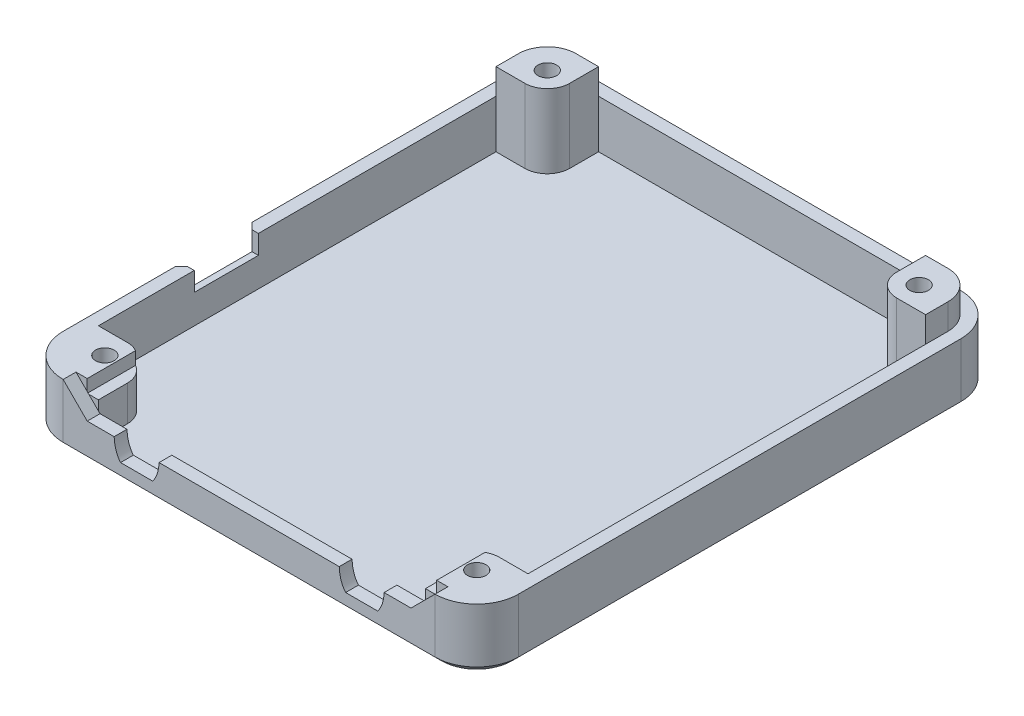
from build123d import *

# Parameters (mm, degrees)
BOSS_EXTRUDE1_DEPTH                                = 9.5
BOSS_EXTRUDE2_DEPTH                                = 2
BOSS_EXTRUDE4_DEPTH                                = 11.5
BOSS_EXTRUDE6_DEPTH                                = 7.5
CUT_EXTRUDE1_DEPTH                                 = 2
CUT_EXTRUDE2_REACH                                 = 85.313
SKETCH9_W                                          = 10
SKETCH9_H                                          = 3
CHAMFER1_SIZE                                      = 1
CHAMFER2_SIZE                                      = 1
CBORE_FOR_M2_5_PAN_HEAD_MACHINE_SCREW1_D           = 2.9
CBORE_FOR_M2_5_PAN_HEAD_MACHINE_SCREW1_CBORE_D     = 6
CBORE_FOR_M2_5_PAN_HEAD_MACHINE_SCREW1_CBORE_DEPTH = 2.1
CBORE_FOR_M2_5_PAN_HEAD_MACHINE_SCREW2_D           = 2.9
CBORE_FOR_M2_5_PAN_HEAD_MACHINE_SCREW2_CBORE_D     = 6
CBORE_FOR_M2_5_PAN_HEAD_MACHINE_SCREW2_CBORE_DEPTH = 2.1
CBORE_FOR_M2_5_PAN_HEAD_MACHINE_SCREW3_D           = 2.9
CBORE_FOR_M2_5_PAN_HEAD_MACHINE_SCREW3_CBORE_D     = 6
CBORE_FOR_M2_5_PAN_HEAD_MACHINE_SCREW3_CBORE_DEPTH = 2.1
CBORE_FOR_M2_5_PAN_HEAD_MACHINE_SCREW4_D           = 2.9
CBORE_FOR_M2_5_PAN_HEAD_MACHINE_SCREW4_CBORE_D     = 6
CBORE_FOR_M2_5_PAN_HEAD_MACHINE_SCREW4_CBORE_DEPTH = 2.1
SKETCH18_W                                         = 54.5
SKETCH18_H                                         = 7.531088913
CUT_EXTRUDE3_DEPTH                                 = 2


with BuildPart() as part:
    # Sketch2 → Boss-Extrude1 (new body)
    with BuildSketch(Plane(origin=(0, 0, 0), x_dir=(1, 0, 0), z_dir=(0, 1, 0))):
        with BuildLine():
            Line((-30.346153846, 41.446848386), (27.653846154, 41.446848386))
            ThreePointArc((27.653846154, 41.446848386), (32.250040232, 39.543042463), (34.153846154, 34.946848386))
            Line((34.153846154, 34.946848386), (34.153846154, -34.053151614))
            ThreePointArc((34.153846154, -34.053151614), (32.250040232, -38.649345692), (27.653846154, -40.553151614))
            Line((27.653846154, -40.553151614), (-30.346153846, -40.553151614))
            ThreePointArc((-30.346153846, -40.553151614), (-34.942347924, -38.649345692), (-36.846153846, -34.053151614))
            Line((-36.846153846, -34.053151614), (-36.846153846, 34.946848386))
            ThreePointArc((-36.846153846, 34.946848386), (-34.942347924, 39.543042463), (-30.346153846, 41.446848386))
        make_face()
        with BuildLine():
            Line((-30.346153846, 39.446848386), (27.653846154, 39.446848386))
            ThreePointArc((27.653846154, 39.446848386), (30.835826669, 38.128828901), (32.153846154, 34.946848386))
            Line((32.153846154, 34.946848386), (32.153846154, -34.053151614))
            ThreePointArc((32.153846154, -34.053151614), (30.835826669, -37.23513213), (27.653846154, -38.553151614))
            Line((27.653846154, -38.553151614), (-30.346153846, -38.553151614))
            ThreePointArc((-30.346153846, -38.553151614), (-33.528134361, -37.23513213), (-34.846153846, -34.053151614))
            Line((-34.846153846, -34.053151614), (-34.846153846, 34.946848386))
            ThreePointArc((-34.846153846, 34.946848386), (-33.528134361, 38.128828901), (-30.346153846, 39.446848386))
        make_face(mode=Mode.SUBTRACT)
    extrude(amount=BOSS_EXTRUDE1_DEPTH)

    # Sketch3 → Boss-Extrude2 (add)
    with BuildSketch(Plane(origin=(0, 0, 0), x_dir=(1, 0, 0), z_dir=(0, 1, 0))):
        with BuildLine():
            Line((-30.346153846, -38.553151614), (27.653846154, -38.553151614))
            ThreePointArc((27.653846154, -38.553151614), (30.835826669, -37.23513213), (32.153846154, -34.053151614))
            Line((32.153846154, -34.053151614), (32.153846154, 34.946848386))
            ThreePointArc((32.153846154, 34.946848386), (30.835826669, 38.128828901), (27.653846154, 39.446848386))
            Line((27.653846154, 39.446848386), (-30.346153846, 39.446848386))
            ThreePointArc((-30.346153846, 39.446848386), (-33.528134361, 38.128828901), (-34.846153846, 34.946848386))
            Line((-34.846153846, 34.946848386), (-34.846153846, -34.053151614))
            ThreePointArc((-34.846153846, -34.053151614), (-33.528134361, -37.23513213), (-30.346153846, -38.553151614))
        make_face()
    extrude(amount=BOSS_EXTRUDE2_DEPTH)

    # Sketch6 → Boss-Extrude4 (add)
    with BuildSketch(Plane(origin=(0, 2, 0), x_dir=(1, 0, 0), z_dir=(0, 1, 0))):
        with BuildLine():
            Line((-26.846153846, 34.946848386), (-26.846153846, 39.446848386))
            Line((-26.846153846, 39.446848386), (-30.346153846, 39.446848386))
            ThreePointArc((-30.346153846, 39.446848386), (-33.528134361, 38.128828901), (-34.846153846, 34.946848386))
            Line((-34.846153846, 34.946848386), (-34.846153846, 31.446848386))
            Line((-34.846153846, 31.446848386), (-30.346153846, 31.446848386))
            ThreePointArc((-30.346153846, 31.446848386), (-27.871280112, 32.471974652), (-26.846153846, 34.946848386))
        make_face()
        with BuildLine():
            Line((24.153846154, 34.946848386), (24.153846154, 39.446848386))
            Line((24.153846154, 39.446848386), (27.653846154, 39.446848386))
            ThreePointArc((27.653846154, 39.446848386), (30.835826669, 38.128828901), (32.153846154, 34.946848386))
            Line((32.153846154, 34.946848386), (32.153846154, 31.446848386))
            Line((32.153846154, 31.446848386), (27.653846154, 31.446848386))
            ThreePointArc((27.653846154, 31.446848386), (25.17897242, 32.471974652), (24.153846154, 34.946848386))
        make_face()
    extrude(amount=BOSS_EXTRUDE4_DEPTH)

    # Sketch8 → Boss-Extrude6 (add)
    with BuildSketch(Plane(origin=(0, 2, 0), x_dir=(1, 0, 0), z_dir=(0, 1, 0))):
        with BuildLine():
            Line((32.153846154, -30.553151614), (32.153846154, -34.053151614))
            ThreePointArc((32.153846154, -34.053151614), (30.835826669, -37.23513213), (27.653846154, -38.553151614))
            Line((27.653846154, -38.553151614), (24.153846154, -38.553151614))
            Line((24.153846154, -38.553151614), (24.153846154, -34.053151614))
            ThreePointArc((24.153846154, -34.053151614), (25.17897242, -31.57827788), (27.653846154, -30.553151614))
            Line((27.653846154, -30.553151614), (32.153846154, -30.553151614))
        make_face()
        with BuildLine():
            Line((-34.846153846, -30.553151614), (-34.846153846, -34.053151614))
            ThreePointArc((-34.846153846, -34.053151614), (-33.528134361, -37.23513213), (-30.346153846, -38.553151614))
            Line((-30.346153846, -38.553151614), (-26.846153846, -38.553151614))
            Line((-26.846153846, -38.553151614), (-26.846153846, -34.053151614))
            ThreePointArc((-26.846153846, -34.053151614), (-27.871280112, -31.57827788), (-30.346153846, -30.553151614))
            Line((-30.346153846, -30.553151614), (-34.846153846, -30.553151614))
        make_face()
    extrude(amount=BOSS_EXTRUDE6_DEPTH)

    # Sketch7 → Cut-Extrude1 (cut)
    with BuildSketch(Plane.XY.offset(40.553151614)):
        with BuildLine():
            Line((27.653846154, 9.5), (-30.346153846, 9.5))
            Line((-30.346153846, 9.5), (-26.595001855, 5.748848009))
            Line((-26.595001855, 5.748848009), (-22.39693017, 5.748848009))
            add(Edge.make_bspline(
                [(-22.39693017, 5.748848009), (-22.318478092, 3.867695791), (-21.39693017, 2.748848009)],
                knots=[0, 0, 0, 0.447396811, 0.447396811, 0.447396811], degree=2))
            Line((-21.39693017, 2.748848009), (-16.39693017, 2.748848009))
            add(Edge.make_bspline(
                [(-15.39693017, 5.748848009), (-15.475382247, 3.867695791), (-16.39693017, 2.748848009)],
                knots=[0, 0, 0, 0.447396811, 0.447396811, 0.447396811], degree=2))
            Line((-15.39693017, 5.748848009), (12.704622477, 5.748848009))
            add(Edge.make_bspline(
                [(12.704622477, 5.748848009), (12.783074555, 3.867695791), (13.704622477, 2.748848009)],
                knots=[0, 0, 0, 0.447396811, 0.447396811, 0.447396811], degree=2))
            Line((13.704622477, 2.748848009), (18.704622477, 2.748848009))
            add(Edge.make_bspline(
                [(19.704622477, 5.748848009), (19.6261704, 3.867695791), (18.704622477, 2.748848009)],
                knots=[0, 0, 0, 0.447396811, 0.447396811, 0.447396811], degree=2))
            Line((19.704622477, 5.748848009), (23.902694163, 5.748848009))
            Line((23.902694163, 5.748848009), (27.653846154, 9.5))
        make_face()
    extrude(amount=-CUT_EXTRUDE1_DEPTH, mode=Mode.SUBTRACT)

    # Sketch9 → Cut-Extrude2 (cut, up to next)
    with BuildSketch(Plane.ZY.offset(36.846153846), mode=Mode.PRIVATE) as cut_extrude2_sk1:
        with Locations((10.60615222, 8.033769059)):
            Rectangle(SKETCH9_W, SKETCH9_H)
    cut_extrude2_tool1 = extrude(cut_extrude2_sk1.sketch, amount=-CUT_EXTRUDE2_REACH, mode=Mode.PRIVATE) & part.part
    add(cut_extrude2_tool1.solids().sort_by_distance((-36.846154, 8.033769, 10.606152))[0], mode=Mode.SUBTRACT)

    # Chamfer1
    chamfer1_edges = [part.edges().sort_by_distance(p)[0] for p in [
        (-36.846153846, 8.01688453, 15.60615222),
        (-36.846153846, 8.01688453, 5.60615222),
        (-36.846153846, 6.533769059, 10.60615222),
    ]]
    chamfer(chamfer1_edges, length=CHAMFER1_SIZE)

    # Chamfer2
    chamfer2_edges = [part.edges().sort_by_distance(p)[0] for p in [
        (-36.846153846, 0, -0.446848386),
        (-34.942347924, 0, -39.543042463),
        (-1.346153846, 0, -41.446848386),
        (32.250040232, 0, -39.543042463),
        (34.153846154, 0, -0.446848386),
        (32.250040232, 0, 38.649345692),
        (-1.346153846, 0, 40.553151614),
        (-34.942347924, 0, 38.649345692),
    ]]
    chamfer(chamfer2_edges, length=CHAMFER2_SIZE)

    # CBORE for M2.5 Pan Head Machine Screw1 (through all)
    with Locations(Plane(origin=(0, 0, 0), x_dir=(-1, 0, 0), z_dir=(0, -1, 0))):
        with Locations((-27.653846154, 34.946848386)):
            CounterBoreHole(CBORE_FOR_M2_5_PAN_HEAD_MACHINE_SCREW1_D / 2, CBORE_FOR_M2_5_PAN_HEAD_MACHINE_SCREW1_CBORE_D / 2, CBORE_FOR_M2_5_PAN_HEAD_MACHINE_SCREW1_CBORE_DEPTH)

    # CBORE for M2.5 Pan Head Machine Screw2 (through all)
    with Locations(Plane(origin=(0, 0, 0), x_dir=(-1, 0, 0), z_dir=(0, -1, 0))):
        with Locations((30.346153846, 34.946848386)):
            CounterBoreHole(CBORE_FOR_M2_5_PAN_HEAD_MACHINE_SCREW2_D / 2, CBORE_FOR_M2_5_PAN_HEAD_MACHINE_SCREW2_CBORE_D / 2, CBORE_FOR_M2_5_PAN_HEAD_MACHINE_SCREW2_CBORE_DEPTH)

    # CBORE for M2.5 Pan Head Machine Screw3 (through all)
    with Locations(Plane(origin=(0, 0, 0), x_dir=(-1, 0, 0), z_dir=(0, -1, 0))):
        with Locations((-27.653846154, -34.053151614)):
            CounterBoreHole(CBORE_FOR_M2_5_PAN_HEAD_MACHINE_SCREW3_D / 2, CBORE_FOR_M2_5_PAN_HEAD_MACHINE_SCREW3_CBORE_D / 2, CBORE_FOR_M2_5_PAN_HEAD_MACHINE_SCREW3_CBORE_DEPTH)

    # CBORE for M2.5 Pan Head Machine Screw4 (through all)
    with Locations(Plane(origin=(0, 0, 0), x_dir=(-1, 0, 0), z_dir=(0, -1, 0))):
        with Locations((30.346153846, -34.053151614)):
            CounterBoreHole(CBORE_FOR_M2_5_PAN_HEAD_MACHINE_SCREW4_D / 2, CBORE_FOR_M2_5_PAN_HEAD_MACHINE_SCREW4_CBORE_D / 2, CBORE_FOR_M2_5_PAN_HEAD_MACHINE_SCREW4_CBORE_DEPTH)

    # Sketch18 → Cut-Extrude3 (cut)
    with BuildSketch(Plane(origin=(0, 9.5, 0), x_dir=(1, 0, 0), z_dir=(0, 1, 0))):
        with Locations((-1.346153846, -34.787607158)):
            Rectangle(SKETCH18_W, SKETCH18_H)
    extrude(amount=-CUT_EXTRUDE3_DEPTH, mode=Mode.SUBTRACT)


solid = part.part
